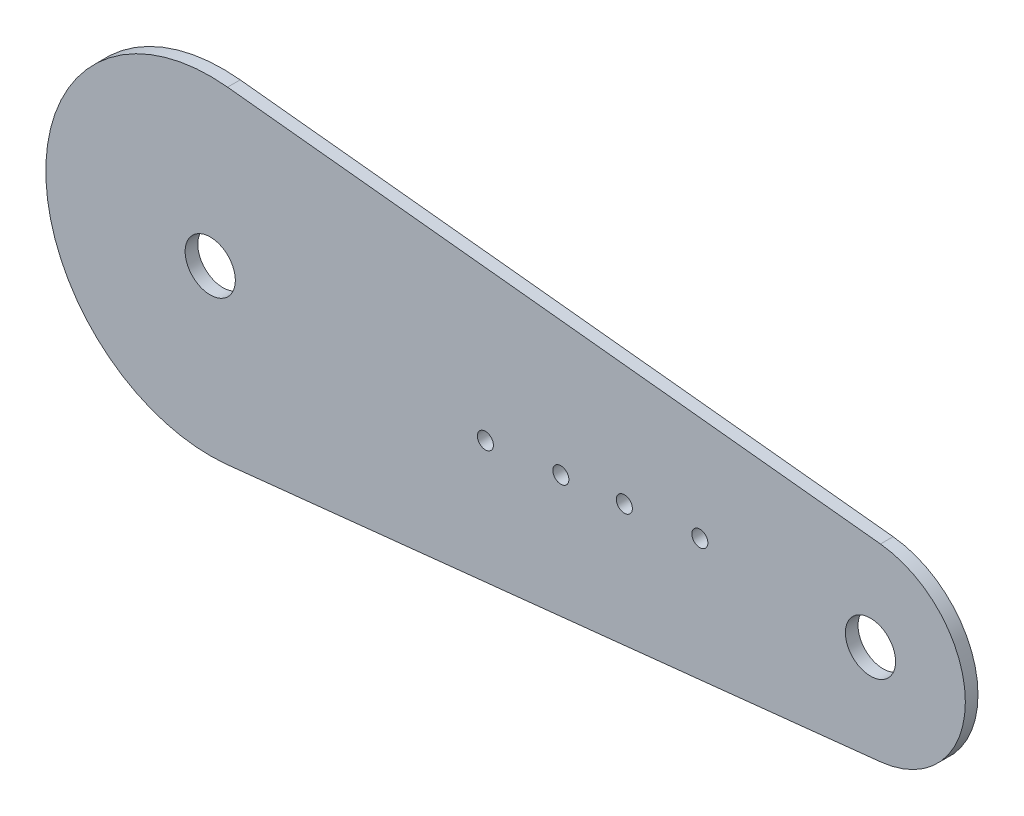
from build123d import *

# Parameters (mm, degrees)
CROQUIS1_R              = 3.175
SALIENTE_EXTRUIR1_DEPTH = 2.5
CROQUIS2_R              = 9.921875
CORTAR_EXTRUIR1_DEPTH   = 10


with BuildPart() as part:
    # Croquis1 → Saliente-Extruir1 (new, symmetric)
    with BuildSketch(Plane.XY):
        with BuildLine():
            Line((-123.651340996, 64.638192037), (134.451149425, 37.291264637))
            ThreePointArc((134.451149425, 37.291264637), (168, 0), (134.451149425, -37.291264637))
            Line((134.451149425, -37.291264637), (-123.651340996, -64.638192037))
            ThreePointArc((-123.651340996, -64.638192037), (-195.5, 0), (-123.651340996, 64.638192037))
        make_face()
        with Locations((63.036149834, 3.50684658)):
            Circle(CROQUIS1_R, mode=Mode.SUBTRACT)
        with Locations((33.200158154, 0.374179913)):
            Circle(CROQUIS1_R, mode=Mode.SUBTRACT)
        with Locations((-21.73784786, -5.394103642)):
            Circle(CROQUIS1_R, mode=Mode.SUBTRACT)
        with Locations((8.09814382, -2.261436976)):
            Circle(CROQUIS1_R, mode=Mode.SUBTRACT)
    extrude(amount=SALIENTE_EXTRUIR1_DEPTH, both=True)

    # Croquis2 → Cortar-Extruir1 (cut)
    with BuildSketch(Plane.XY.offset(2.5)):
        with Locations((-130.5, 0)):
            Circle(CROQUIS2_R)
        with Locations((130.5, 0)):
            Circle(CROQUIS2_R)
    extrude(amount=-CORTAR_EXTRUIR1_DEPTH, mode=Mode.SUBTRACT)


solid = part.part
